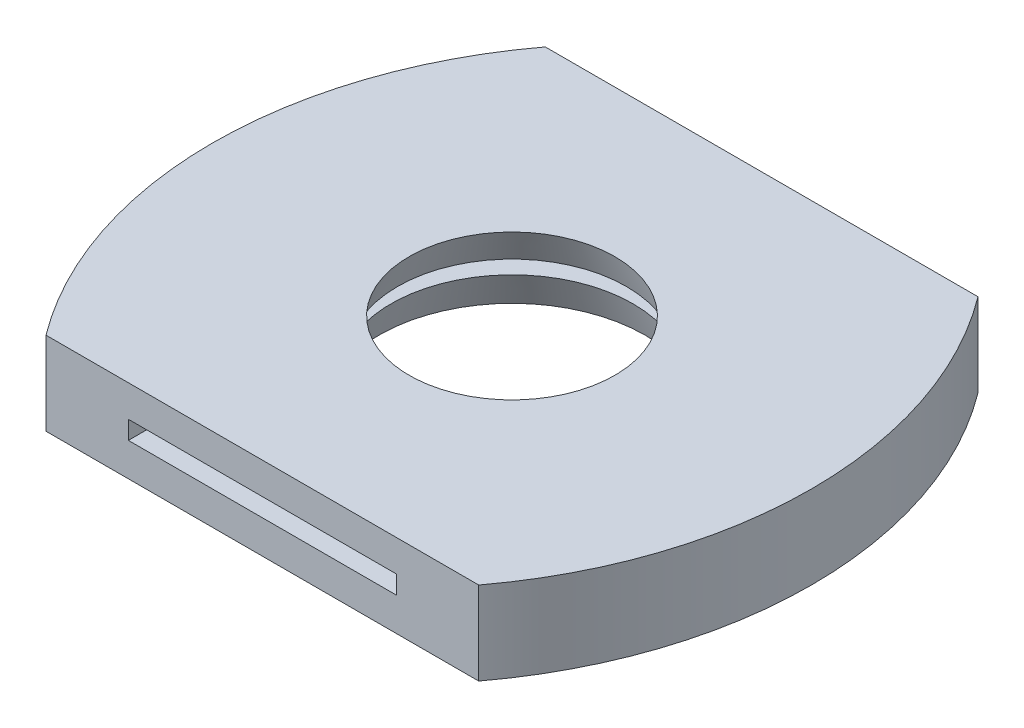
from build123d import *

# Parameters (mm, degrees)
BOSS_EXTRUDE1_DEPTH  = 50
CARBON_FILTER_HOLE_W = 161
CARBON_FILTER_HOLE_H = 11
CUT_EXTRUDE3_DEPTH   = 280
SKETCH1_R            = 3
CUT_EXTRUDE4_DEPTH   = 20


with BuildPart() as part:
    # Lid case → Boss-Extrude1 (new body)
    with BuildSketch(Plane(origin=(0, 0, 0), x_dir=(1, 0, 0), z_dir=(0, 1, 0))):
        with BuildLine():
            Line((-130, 150), (130, 150))
            ThreePointArc((130, 150), (180, 0), (130, -150))
            Line((130, -150), (-130, -150))
            ThreePointArc((-130, -150), (-180, 0), (-130, 150))
        make_face()
    extrude(amount=BOSS_EXTRUDE1_DEPTH)

    # Ventilation → Cut-Revolve1 (revolve, cut)
    with BuildSketch(Plane.XY, mode=Mode.PRIVATE) as cut_revolve1_sk:
        Polygon((0, 50), (0, 0), (-80, 0), (-61.801488287, 50), align=None)
    revolve(cut_revolve1_sk.sketch.rotate(Axis((0, -54.373231572, 0), (0, 1, 0)), 270), axis=Axis((0, -54.373231572, 0), (0, 1, 0)), mode=Mode.SUBTRACT)

    # Carbon filter hole → Cut-Extrude3 (cut)
    with BuildSketch(Plane.XY.offset(150)):
        with Locations((0, 25.5)):
            Rectangle(CARBON_FILTER_HOLE_W, CARBON_FILTER_HOLE_H)
    extrude(amount=-CUT_EXTRUDE3_DEPTH, mode=Mode.SUBTRACT)

    # Sketch1 → Cut-Extrude4 (cut)
    with BuildSketch(Plane.XZ):
        with Locations(Location((-110, -139, 0), (0, 0, 270))):
            Circle(SKETCH1_R)
        with Locations(Location((-82, -139, 0), (0, 0, 270))):
            Circle(SKETCH1_R)
        with Locations(Location((-54, -139, 0), (0, 0, 270))):
            Circle(SKETCH1_R)
        with Locations(Location((54, -139, 0), (0, 0, 270))):
            Circle(SKETCH1_R)
        with Locations(Location((82, -139, 0), (0, 0, 270))):
            Circle(SKETCH1_R)
        with Locations(Location((110, -139, 0), (0, 0, 270))):
            Circle(SKETCH1_R)
    extrude(amount=-CUT_EXTRUDE4_DEPTH, mode=Mode.SUBTRACT)


solid = part.part
